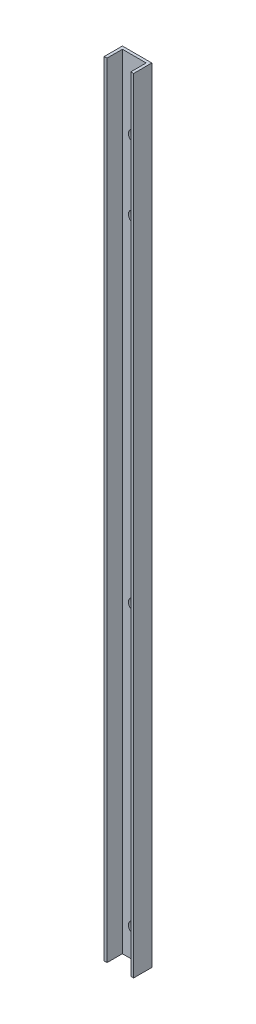
from build123d import *

# Parameters (mm, degrees)
EXTRUDE_THIN1_DEPTH = 280
SKETCH2_R           = 2.1
CUT_EXTRUDE1_DEPTH  = 10


with BuildPart() as part:
    # Sketch1 → Extrude-Thin1 (new body)
    with BuildSketch(Plane(origin=(0, 0, 0), x_dir=(1, 0, 0), z_dir=(0, 1, 0))):
        Polygon((-3.469957082, -1.813304721), (-3.469957082, 4.686695279), (7.030042918, 4.686695279), (7.030042918, -1.813304721), (6.030042918, -1.813304721), (6.030042918, 3.686695279), (-2.469957082, 3.686695279), (-2.469957082, -1.813304721), align=None)
    extrude(amount=EXTRUDE_THIN1_DEPTH)

    # Sketch2 → Cut-Extrude1 (cut)
    with BuildSketch(Plane(origin=(0, 0, -4.686695279), x_dir=(-1, 0, 0), z_dir=(0, 0, -1))):
        with Locations((-1.780042918, 230)):
            Circle(SKETCH2_R)
        with Locations((-1.780042918, 255)):
            Circle(SKETCH2_R)
        with Locations((-1.780042918, 110)):
            Circle(SKETCH2_R)
        with Locations((-1.780042918, 10)):
            Circle(SKETCH2_R)
    extrude(amount=-CUT_EXTRUDE1_DEPTH, mode=Mode.SUBTRACT)


solid = part.part
